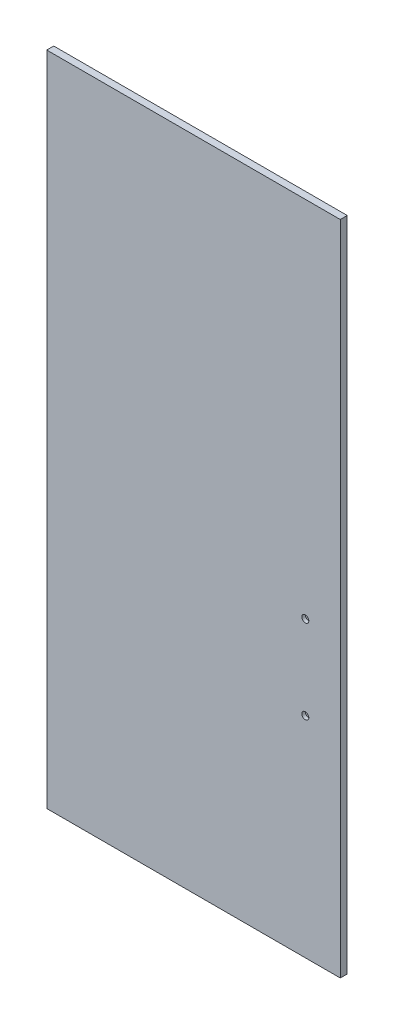
from build123d import *

# Parameters (mm, degrees)
SKETCH_1_W          = 420
SKETCH_1_H          = 940
EXTRUDE_1_DEPTH     = 10
SKETCH_2_R          = 5
CUT_EXTRUDE_1_DEPTH = 5


with BuildPart() as part:
    # Эскиз1 → Бобышка-Вытянуть1 (new body)
    with BuildSketch(Plane.XY):
        with Locations((210, 470)):
            Rectangle(SKETCH_1_W, SKETCH_1_H)
    extrude(amount=EXTRUDE_1_DEPTH)

    # Эскиз2 → Вырез-Вытянуть1 (cut)
    with BuildSketch(Plane.XY.offset(10)):
        with Locations((370, 420)):
            Circle(SKETCH_2_R)
        with Locations((370, 300)):
            Circle(SKETCH_2_R)
    extrude(amount=-CUT_EXTRUDE_1_DEPTH, mode=Mode.SUBTRACT)


solid = part.part
